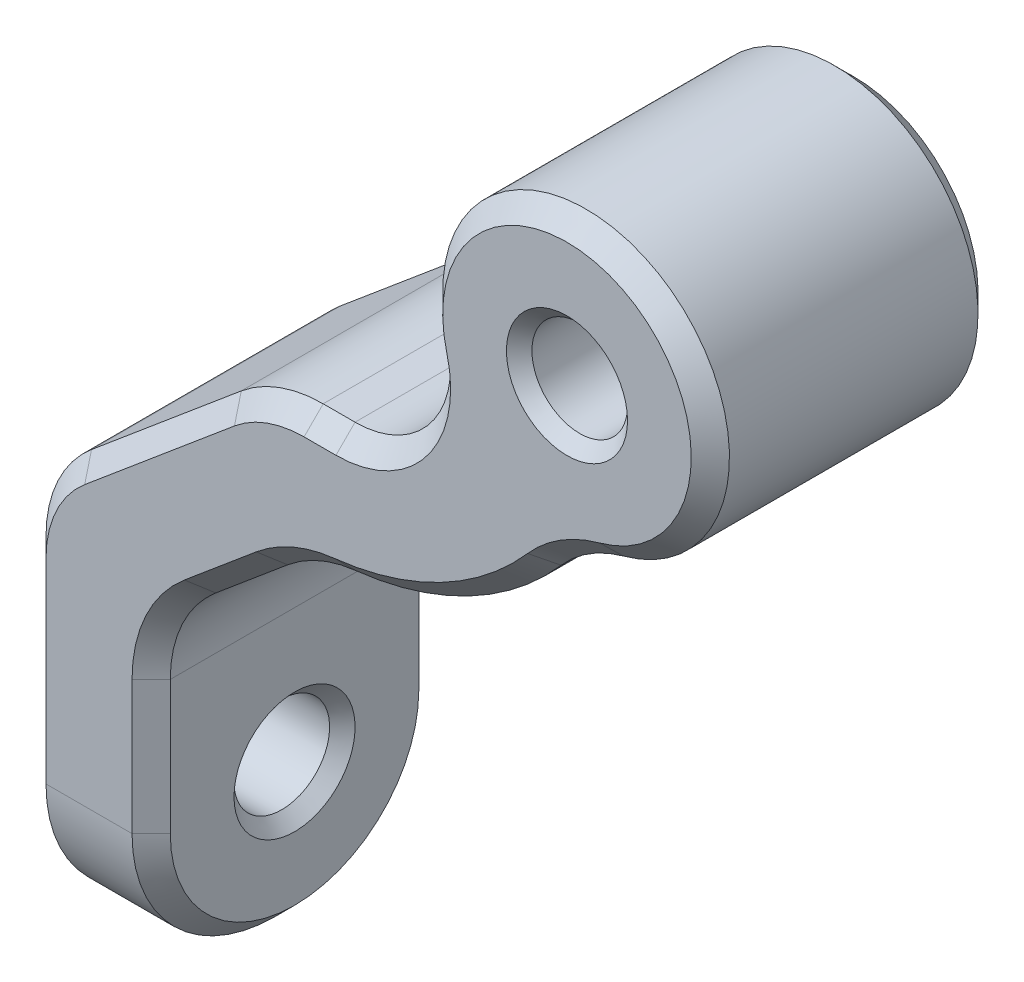
from build123d import *

# Parameters (mm, degrees)
SKETCH1_R           = 1.5
BOSS_EXTRUDE1_DEPTH = 4.5
FILLET1_RADIUS      = 4.5
FILLET1_LENGTH      = 3.9
CUT_EXTRUDE1_REACH  = 37.558
SKETCH3_R           = 1.5
CHAMFER1_SIZE       = 0.6
CHAMFER2_SIZE       = 0.4


with BuildPart() as part:
    # Sketch1 → Boss-Extrude1 (new, symmetric)
    with BuildSketch(Plane.XY):
        with BuildLine():
            Line((-13.05, 0), (-13.05, 8.691684344))
            ThreePointArc((-13.05, 8.691684344), (-12.675231148, 10.382157391), (-11.621150439, 11.755862116))
            Line((-11.621150439, 11.755862116), (-9.365773473, 13.648348096))
            ThreePointArc((-9.365773473, 13.648348096), (-8.36559922, 14.262761606), (-7.230139126, 14.560390355))
            ThreePointArc((-7.230139126, 14.560390355), (-3.689610404, 15.637001914), (-0.783040807, 17.927479867))
            ThreePointArc((-0.783040807, 17.927479867), (0.108053117, 18.688045586), (1.181284206, 19.15781534))
            ThreePointArc((1.181284206, 19.15781534), (2.248897725, 27.397750508), (-4.350434235, 22.349468831))
            ThreePointArc((-4.350434235, 22.349468831), (-4.87363913, 19.752292641), (-7.250723724, 18.582448052))
            Line((-7.250723724, 18.582448052), (-8.250559688, 18.582448052))
            ThreePointArc((-8.250559688, 18.582448052), (-9.618640261, 18.341218535), (-10.821710127, 17.646625825))
            Line((-10.821710127, 17.646625825), (-15.521150439, 13.703327192))
            ThreePointArc((-15.521150439, 13.703327192), (-16.575231148, 12.329622467), (-16.95, 10.63914942))
            Line((-16.95, 10.63914942), (-16.95, 0))
            Line((-16.95, 0), (-13.05, 0))
        make_face()
        with Locations((0, 23.5)):
            Circle(SKETCH1_R, mode=Mode.SUBTRACT)
    extrude(amount=BOSS_EXTRUDE1_DEPTH, both=True)

    # Fillet1: full round fillet: the end face becomes a half cylinder, R = half its width
    fillet1_face = Plane((-15, 0, 0), x_dir=(-1, 0, 0), z_dir=(0, -1, 0))  # on the end face: x along it, z out of the body
    fillet1_slab = fillet1_face.offset(-FILLET1_RADIUS / 2) * Box(FILLET1_LENGTH, 2 * FILLET1_RADIUS, FILLET1_RADIUS, mode=Mode.PRIVATE)  # the body's end, R deep
    fillet1_round = Plane((-15, 4.5, 0), x_dir=(0, -1, 0), z_dir=(-1, 0, 0)) * Cylinder(FILLET1_RADIUS, FILLET1_LENGTH, mode=Mode.PRIVATE)  # its axis R under the face
    add(fillet1_slab - fillet1_round, mode=Mode.SUBTRACT)

    # Sketch3 → Cut-Extrude1 (cut, up to next)
    with BuildSketch(Plane.ZY.offset(16.95), mode=Mode.PRIVATE) as cut_extrude1_sk1:
        with Locations((0, 4.5)):
            Circle(SKETCH3_R)
    cut_extrude1_tool1 = extrude(cut_extrude1_sk1.sketch, amount=-CUT_EXTRUDE1_REACH, mode=Mode.PRIVATE) & part.part
    add(cut_extrude1_tool1.solids().sort_by_distance((-16.95, 4.5, 0))[0], mode=Mode.SUBTRACT)

    # Chamfer1
    chamfer1_edges = [part.edges().sort_by_distance(p)[0] for p in [
        (-13.171430283, 15.674976508, -4.5),
        (-9.618640261, 18.341218535, -4.5),
        (-7.750641706, 18.582448052, -4.5),
        (-4.87363913, 19.752292641, -4.5),
        (2.248897725, 27.397750508, -4.5),
        (0.108053117, 18.688045586, -4.5),
        (-3.689610404, 15.637001914, -4.5),
        (-8.36559922, 14.262761606, -4.5),
        (-10.493461956, 12.702105106, -4.5),
        (-12.675231148, 10.382157391, 4.5),
        (-12.675231148, 10.382157391, -4.5),
        (-16.95, 7.56957471, -4.5),
        (-16.575231148, 12.329622467, -4.5),
        (-10.493461956, 12.702105106, 4.5),
        (-8.36559922, 14.262761606, 4.5),
        (-3.689610404, 15.637001914, 4.5),
        (0.108053117, 18.688045586, 4.5),
        (2.248897725, 27.397750508, 4.5),
        (-4.87363913, 19.752292641, 4.5),
        (-7.750641706, 18.582448052, 4.5),
        (-16.575231148, 12.329622467, 4.5),
        (-9.618640261, 18.341218535, 4.5),
        (-13.171430283, 15.674976508, 4.5),
        (-13.05, 6.595842172, -4.5),
        (-13.05, 6.595842172, 4.5),
        (-13.05, 0, 0),
        (-16.95, 0, 0),
        (-16.95, 7.56957471, 4.5),
    ]]
    chamfer(chamfer1_edges, length=CHAMFER1_SIZE)

    # Chamfer2
    chamfer2_edges = [part.edges().sort_by_distance(p)[0] for p in [
        (-1.5, 23.5, -4.5),
        (-1.5, 23.5, 4.5),
        (-16.95, 4.5, -1.5),
        (-13.05, 4.5, -1.5),
    ]]
    chamfer(chamfer2_edges, length=CHAMFER2_SIZE)


solid = part.part
